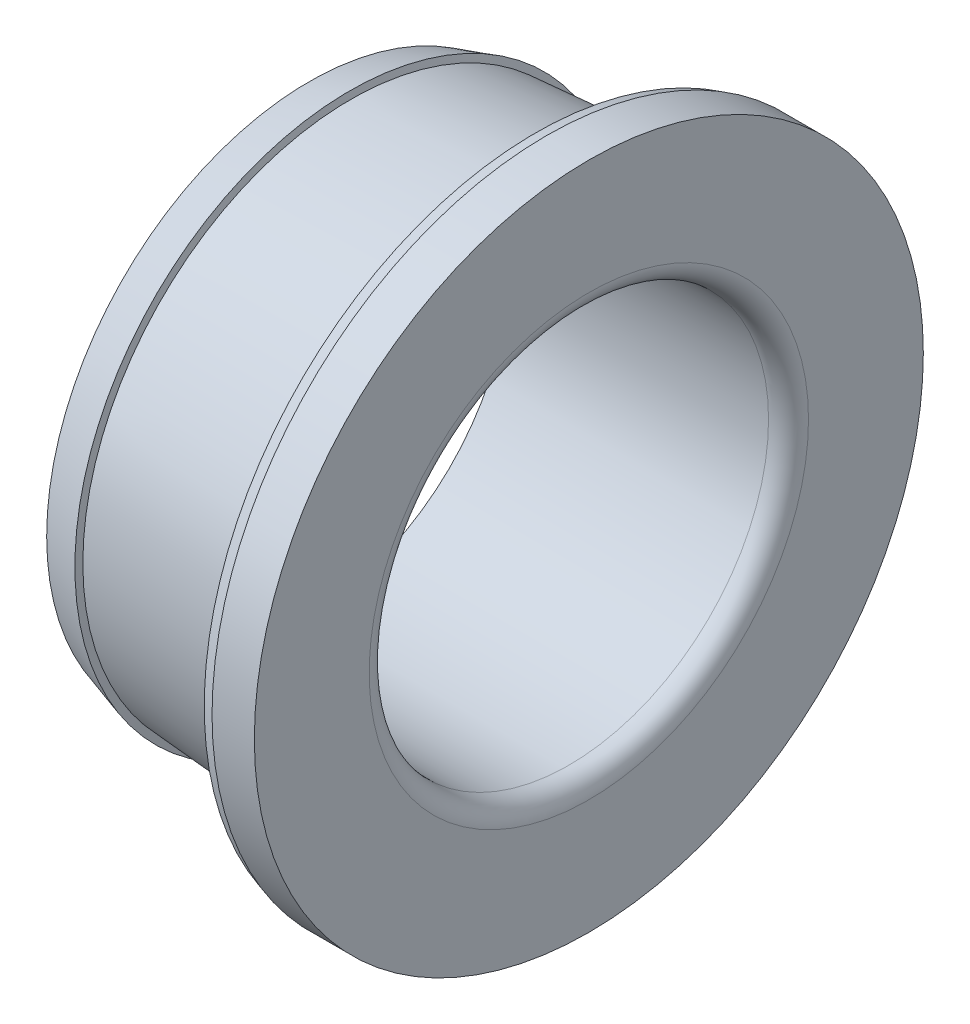
from build123d import *


with BuildPart() as part:
    # ｽｹｯﾁ1 → 回転1 (revolve)
    with BuildSketch(Plane.XY, mode=Mode.PRIVATE) as revolve_1_sk:
        with BuildLine():
            Line((1.25, 13.149), (1.25, 10))
            Line((1.25, 10), (14.25, 10))
            ThreePointArc((14.25, 10), (14.957106781, 10.292893219), (15.25, 11))
            Line((15.25, 11), (15.25, 16.75))
            Line((15.25, 16.75), (13.131049, 16.75))
            Line((13.131049, 16.75), (12.570253493, 16.580029771))
            Line((12.570253493, 16.580029771), (12.9498679, 14.104804989))
            Line((12.9498679, 14.104804989), (3.329373052, 13.418096908))
            Line((3.329373052, 13.418096908), (3.276447429, 13.763191322))
            Line((3.276447429, 13.763191322), (1.25, 13.149))
        make_face()
    revolve(revolve_1_sk.sketch.rotate(Axis((1.25, 0, 0), (1, 0, 0)), 270), axis=Axis((1.25, 0, 0), (1, 0, 0)))


solid = part.part
